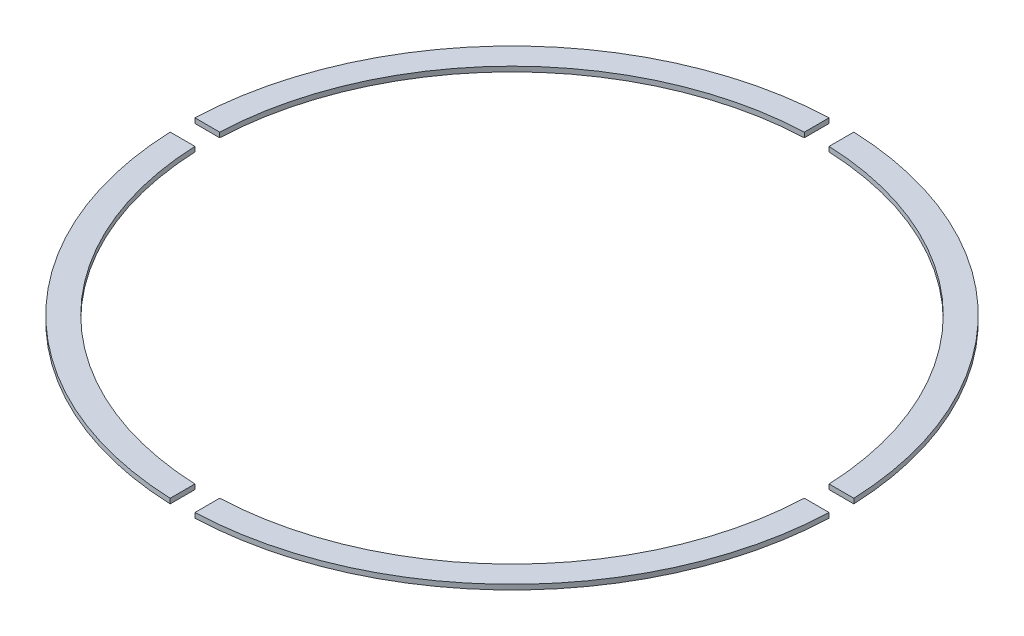
from build123d import *

# Parameters (mm, degrees)
SKETCH1_R           = 200
SKETCH1_R_2         = 185
BOSS_EXTRUDE1_DEPTH = 1.5
SKETCH2_W           = 69.71067633
SKETCH2_H           = 15
CUT_EXTRUDE1_DEPTH  = 283.846689922
CIRPATTERN1_COUNT   = 4


with BuildPart() as part:
    # Sketch1 → Boss-Extrude1 (new, symmetric)
    with BuildSketch(Plane(origin=(0, 0, 0), x_dir=(1, 0, 0), z_dir=(0, 1, 0))):
        with Locations(Location((0, 0, 0), (0, 0, 270))):
            Circle(SKETCH1_R)
        with Locations(Location((0, 0, 0), (0, 0, 270))):
            Circle(SKETCH1_R_2, mode=Mode.SUBTRACT)
    extrude(amount=BOSS_EXTRUDE1_DEPTH, both=True)

    # Sketch2 → Cut-Extrude1 (cut, symmetric)
    with BuildSketch(Plane(origin=(0, 0, 0), x_dir=(1, 0, 0), z_dir=(0, 1, 0))):
        with Locations((192.5, 0)):
            Rectangle(SKETCH2_W, SKETCH2_H)
    cut_extrude1 = extrude(amount=CUT_EXTRUDE1_DEPTH, both=True, mode=Mode.SUBTRACT)

    # CirPattern1: Cut-Extrude1 ×4 about axis
    cirpattern1_axis = Axis((0, 0, 0), (0, 1, 0))
    for i in range(1, CIRPATTERN1_COUNT):
        add(cut_extrude1.rotate(cirpattern1_axis, i * 360 / CIRPATTERN1_COUNT), mode=Mode.SUBTRACT)


solid = part.part
